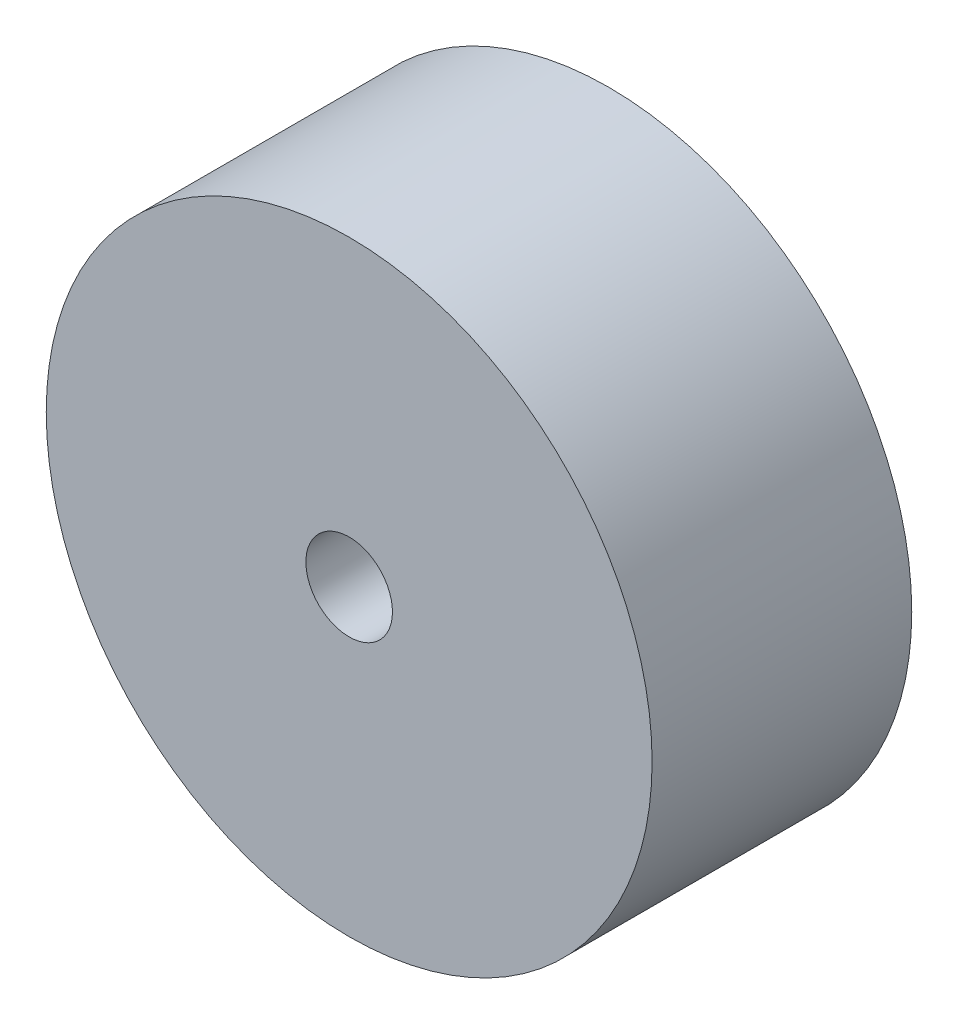
from build123d import *

# Parameters (mm, degrees)
SKETCH1_R           = 35
BOSS_EXTRUDE1_DEPTH = 30
SKETCH2_R           = 5
CUT_EXTRUDE1_DEPTH  = 30


with BuildPart() as part:
    # Sketch1 → Boss-Extrude1 (new body)
    with BuildSketch(Plane.XY):
        Circle(SKETCH1_R)
    extrude(amount=-BOSS_EXTRUDE1_DEPTH)

    # Sketch2 → Cut-Extrude1 (cut)
    with BuildSketch(Plane.XY):
        Circle(SKETCH2_R)
    extrude(amount=-CUT_EXTRUDE1_DEPTH, mode=Mode.SUBTRACT)


solid = part.part
